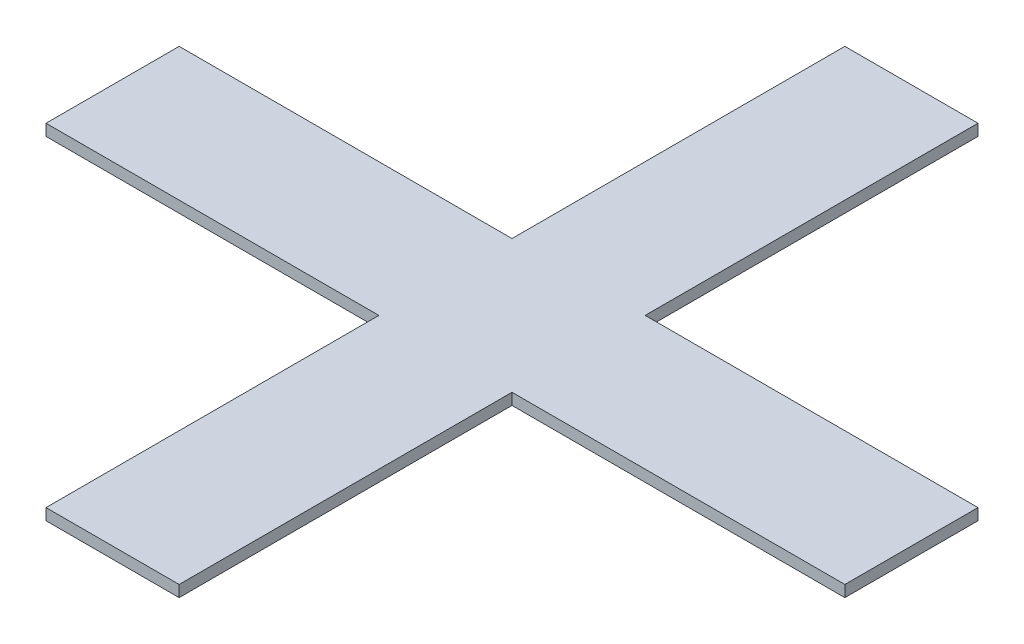
from build123d import *

# Parameters (mm, degrees)
BOSS_EXTRUDE1_DEPTH = 5.15


with BuildPart() as part:
    # Sketch1 → Boss-Extrude1 (new body)
    with BuildSketch(Plane(origin=(0, 0, 0), x_dir=(1, 0, 0), z_dir=(0, 1, 0))):
        Polygon((-180, -30), (-180, 0), (-180, 30), (-30, 30), (-30, 180), (0, 180), (30, 180), (30, 30), (180, 30), (180, 0), (180, -30), (30, -30), (30, -180), (0, -180), (-30, -180), (-30, -30), align=None)
    extrude(amount=BOSS_EXTRUDE1_DEPTH)


solid = part.part
